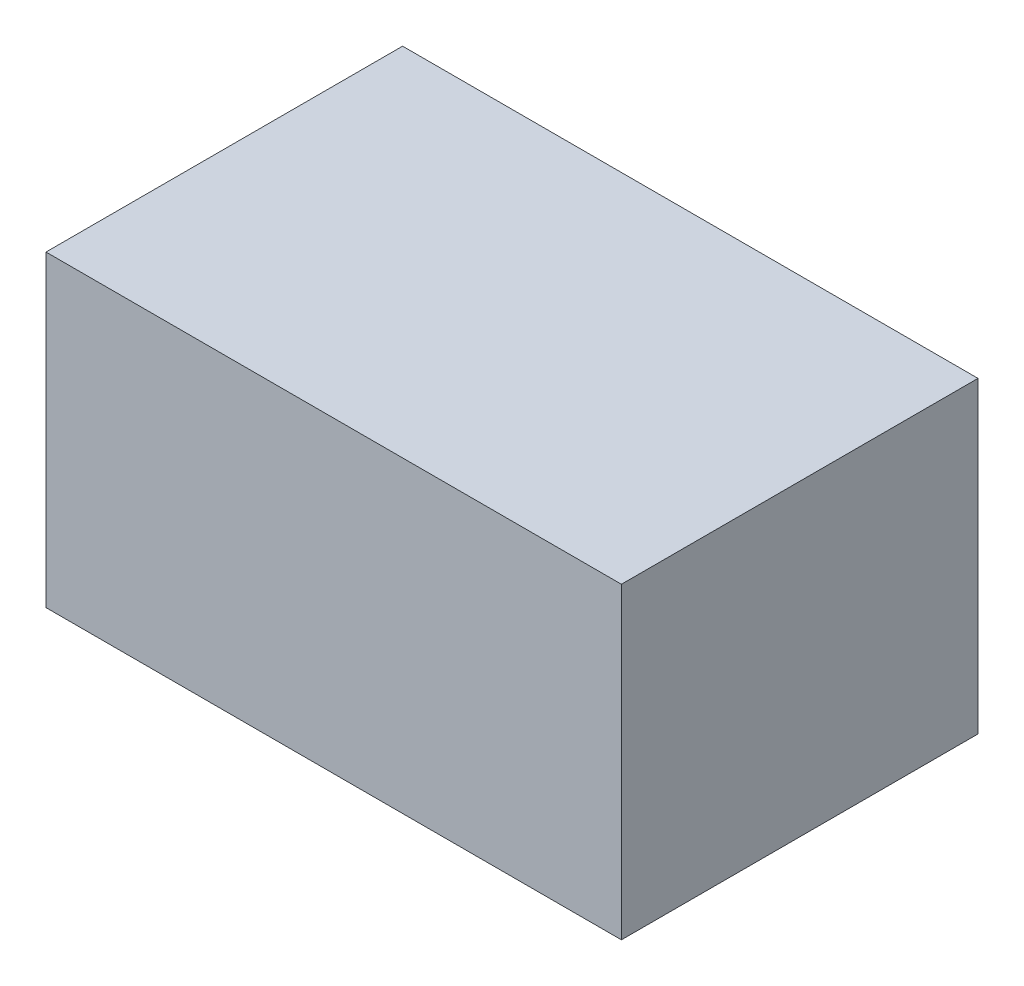
from build123d import *

# Parameters (mm, degrees)
SKETCH1_W           = 710
SKETCH1_H           = 440
BOSS_EXTRUDE1_DEPTH = 380


with BuildPart() as part:
    # Sketch1 → Boss-Extrude1 (new body)
    with BuildSketch(Plane(origin=(0, 0, 0), x_dir=(1, 0, 0), z_dir=(0, 1, 0))):
        Rectangle(SKETCH1_W, SKETCH1_H)
    extrude(amount=BOSS_EXTRUDE1_DEPTH)


solid = part.part
